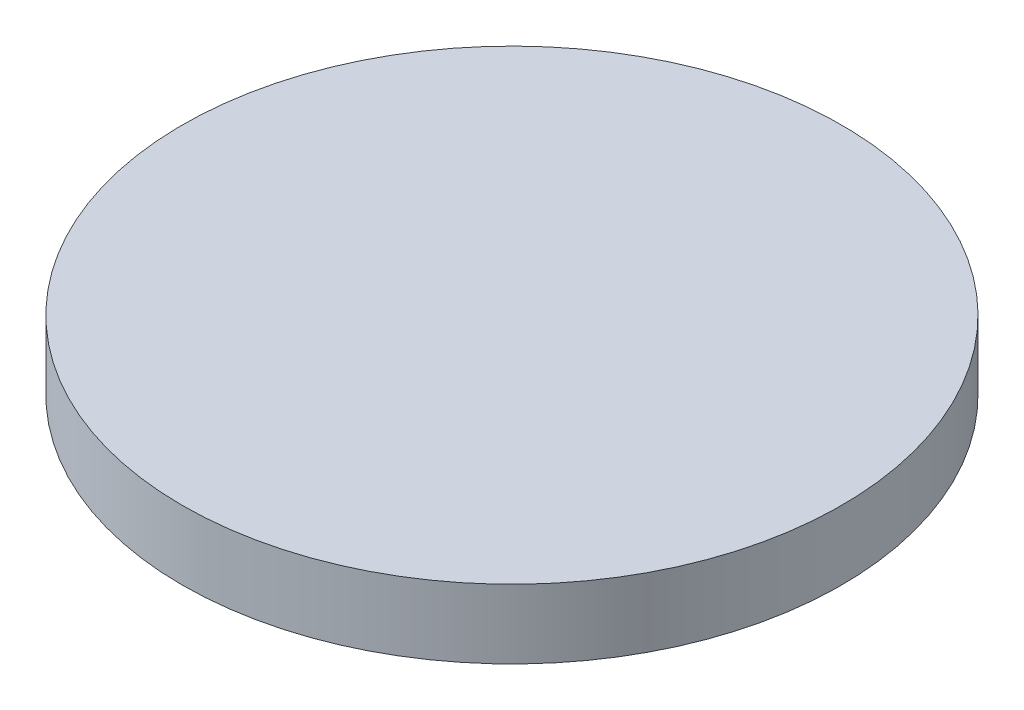
from build123d import *

# Parameters (mm, degrees)
SKETCH1_R           = 10.025000016
BOSS_EXTRUDE1_DEPTH = 2.10000088
SKETCH2_R           = 4.3000041
BOSS_EXTRUDE2_DEPTH = 2.10000088


with BuildPart() as part:
    # Sketch1 → Boss-Extrude1 (new body)
    with BuildSketch(Plane(origin=(0, 0, 0), x_dir=(1, 0, 0), z_dir=(0, 1, 0))):
        with Locations(Location((0, 0, 0), (0, 0, 270))):
            Circle(SKETCH1_R)
    extrude(amount=BOSS_EXTRUDE1_DEPTH)

    # Sketch2 → Boss-Extrude2 (add)
    with BuildSketch(Plane(origin=(0, 0, 0), x_dir=(-1, 0, 0), z_dir=(0, -1, 0))):
        with Locations(Location((0, 0, 0), (0, 0, 90))):
            Circle(SKETCH2_R)
    extrude(amount=BOSS_EXTRUDE2_DEPTH)


solid = part.part
